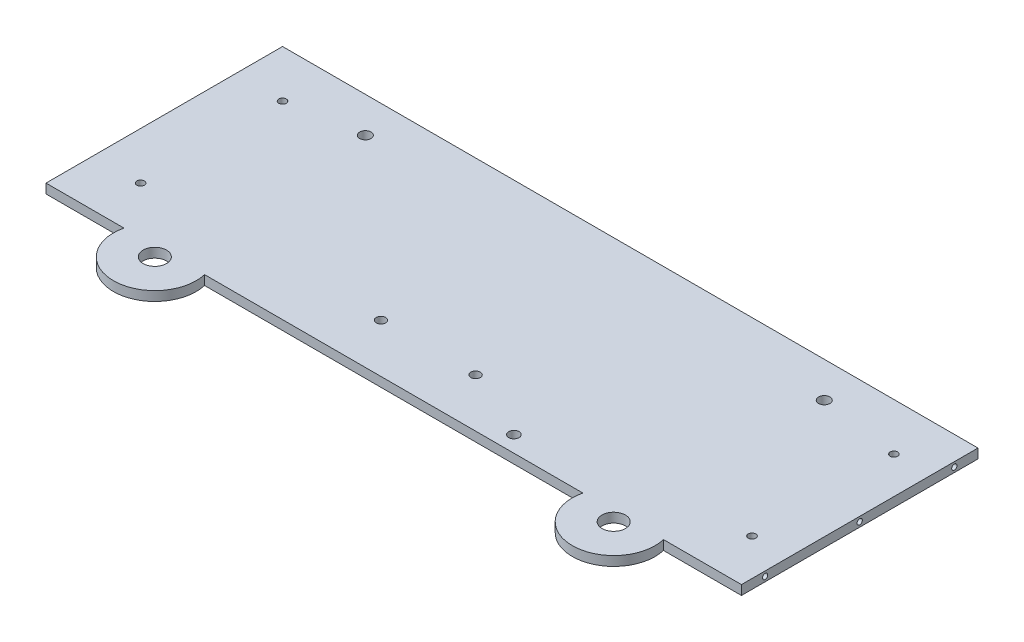
from build123d import *

# Parameters (mm, degrees)
BOSS_EXTRUDE1_DEPTH         = 5.07492
SKETCH1_5_R                 = 6.2865
CUT_EXTRUDE1_DEPTH          = 208.664293845
CUT_EXTRUDE2_DEPTH          = 208.664293845
CUT_EXTRUDE2_DEPTH_BACK     = 208.664293845
SKETCH1_7_R                 = 3.048
SKETCH1_8_R                 = 2.54
CUT_EXTRUDE3_DEPTH          = 208.664293845
F_21_0_159_DIAMETER_HOLE1_D = 4.0386
SKETCH5_R                   = 2.794
CUT_EXTRUDE4_DEPTH          = 5.08
SKETCH6_R                   = 1.4224
CUT_EXTRUDE5_DEPTH          = 12.7
CUT_EXTRUDE6_START          = -12.7
SKETCH7_R                   = 1.4224
CUT_EXTRUDE6_DEPTH          = 12.7


with BuildPart() as part:
    # Sketch1 → Boss-Extrude1 (new body)
    with BuildSketch(Plane(origin=(0, 0, 0), x_dir=(1, 0, 0), z_dir=(0, 1, 0))):
        with BuildLine():
            Line((-186.69, 63.5), (-186.69, -63.5))
            Line((-186.69, -63.5), (-144.826640797, -63.5))
            ThreePointArc((-144.826640797, -63.5), (-123.19, -90.805), (-101.553359203, -63.5))
            Line((-101.553359203, -63.5), (101.553359203, -63.5))
            ThreePointArc((101.553359203, -63.5), (123.19, -90.805), (144.826640797, -63.5))
            Line((144.826640797, -63.5), (186.69, -63.5))
            Line((186.69, -63.5), (186.69, 63.5))
            Line((186.69, 63.5), (-186.69, 63.5))
        make_face()
    extrude(amount=BOSS_EXTRUDE1_DEPTH)

    # Sketch1<5> → Cut-Extrude1 (cut, through all)
    with BuildSketch(Plane(origin=(0, 0, 0), x_dir=(1, 0, 0), z_dir=(0, 1, 0))):
        with Locations((-123.19, -68.58)):
            Circle(SKETCH1_5_R)
        with Locations((123.19, -68.58)):
            Circle(SKETCH1_5_R)
    extrude(amount=CUT_EXTRUDE1_DEPTH, mode=Mode.SUBTRACT)

    # Sketch1<7> → Cut-Extrude2 (cut, two sides: drawn at the far end of the back side and taken through both)
    with BuildSketch(Plane(origin=(0, 0, 0), x_dir=(1, 0, 0), z_dir=(0, 1, 0)).offset(-CUT_EXTRUDE2_DEPTH_BACK)):
        with Locations((-123.19, 44.45)):
            Circle(SKETCH1_7_R)
        with Locations((123.19, 44.45)):
            Circle(SKETCH1_7_R)
    extrude(amount=CUT_EXTRUDE2_DEPTH + CUT_EXTRUDE2_DEPTH_BACK, mode=Mode.SUBTRACT)

    # Sketch1<8> → Cut-Extrude3 (cut, through all)
    with BuildSketch(Plane(origin=(0, 0, 0), x_dir=(1, 0, 0), z_dir=(0, 1, 0))):
        with Locations((-33.02, -37.338)):
            Circle(SKETCH1_8_R)
        with Locations((17.78, -37.338)):
            Circle(SKETCH1_8_R)
    extrude(amount=CUT_EXTRUDE3_DEPTH, mode=Mode.SUBTRACT)

    # #21 (0.159) Diameter Hole1 (through all)
    with Locations(Plane(origin=(0, 5.07492, 0), x_dir=(1, 0, 0), z_dir=(0, 1, 0))):
        with Locations((-161.29, 38.1), (-161.29, -38.1), (166.954317475, -38.1), (166.954317475, 38.1)):
            Hole(F_21_0_159_DIAMETER_HOLE1_D / 2)

    # Sketch5 → Cut-Extrude4 (cut)
    with BuildSketch(Plane(origin=(0, 5.07492, 0), x_dir=(1, 0, 0), z_dir=(0, 1, 0))):
        with Locations((55.88, -54.864)):
            Circle(SKETCH5_R)
    extrude(amount=-CUT_EXTRUDE4_DEPTH, mode=Mode.SUBTRACT)

    # Sketch6 → Cut-Extrude5 (cut)
    with BuildSketch(Plane(origin=(186.69, 0, 0), x_dir=(0, 0, -1), z_dir=(1, 0, 0))):
        with Locations((0, 2.53746)):
            Circle(SKETCH6_R)
        with Locations((-50.8, 2.53746)):
            Circle(SKETCH6_R)
        with Locations((50.8, 2.53746)):
            Circle(SKETCH6_R)
    extrude(amount=-CUT_EXTRUDE5_DEPTH, mode=Mode.SUBTRACT)

    # Sketch7 → Cut-Extrude6 (cut)
    with BuildSketch(Plane.ZY.offset(186.69).offset(CUT_EXTRUDE6_START)):
        with Locations((-50.8, 2.53746)):
            Circle(SKETCH7_R)
        with Locations((0, 2.53746)):
            Circle(SKETCH7_R)
    extrude(amount=CUT_EXTRUDE6_DEPTH, mode=Mode.SUBTRACT)


solid = part.part
